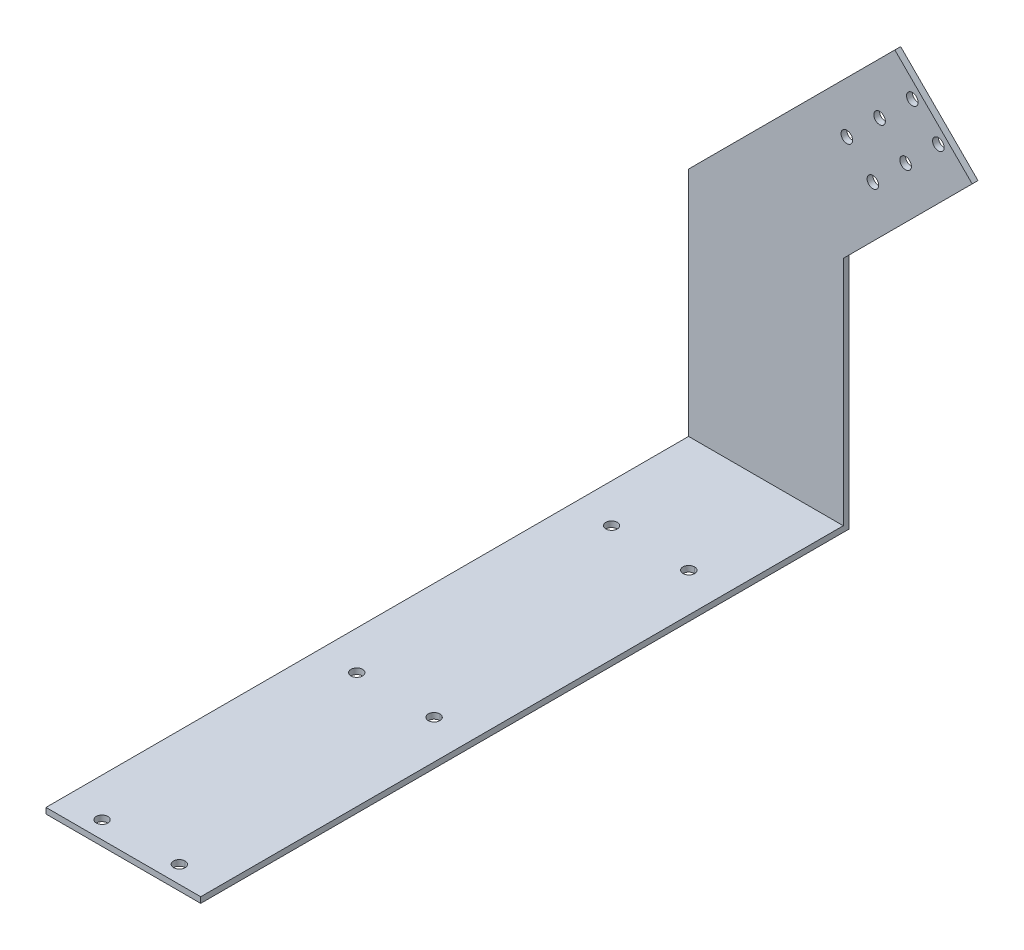
from build123d import *

# Parameters (mm, degrees)
SKETCH1_R           = 161.29
BOSS_EXTRUDE1_DEPTH = 161.29
SKETCH3_W           = 4310.634
SKETCH3_H           = 18064.48
SKETCH3_R           = 161.29
SKETCH3_R_2         = 161.290000004
BOSS_EXTRUDE3_DEPTH = 161.29
SCALE1_SCALE        = 0.039370079


with BuildPart() as part:
    # Sketch1 → Boss-Extrude1 (new body)
    with BuildSketch(Plane.XY):
        Polygon((-2155.317, 3225.8), (3592.046917484, 8973.163917484), (5747.419448428, 6817.902448428), (2155.317, 3225.8), (2155.317, -3225.8), (-2155.317, -3225.8), align=None)
        with Locations((4804.833357851, 7304.254711836)):
            Circle(SKETCH1_R, mode=Mode.SUBTRACT)
        with Locations((3892.43933595, 6391.860689935)):
            Circle(SKETCH1_R, mode=Mode.SUBTRACT)
        with Locations((2980.04531405, 5479.466668034)):
            Circle(SKETCH1_R, mode=Mode.SUBTRACT)
        with Locations(Location((2253.753739605, 6205.720818177, 0), (0, 0, 180))):
            Circle(SKETCH1_R, mode=Mode.SUBTRACT)
        with Locations(Location((3166.100745307, 7118.161853854, 0), (0, 0, 180))):
            Circle(SKETCH1_R, mode=Mode.SUBTRACT)
        with Locations(Location((4078.447751009, 8030.602889531, 0), (0, 0, 180))):
            Circle(SKETCH1_R, mode=Mode.SUBTRACT)
    extrude(amount=BOSS_EXTRUDE1_DEPTH)

    # Sketch3 → Boss-Extrude3 (add)
    with BuildSketch(Plane(origin=(0, -3225.8, 0), x_dir=(-1, 0, 0), z_dir=(0, -1, 0))):
        with Locations((0, -9032.24)):
            Rectangle(SKETCH3_W, SKETCH3_H)
        with BuildLine():
            ThreePointArc((-1076.325000239, -17741.894999924), (-1238.885, -17580.61), (-1076.325000239, -17419.325000076))
            ThreePointArc((-1076.325000239, -17419.325000076), (-961.455647534, -17466.112614792), (-913.765, -17580.61))
            ThreePointArc((-913.765, -17580.61), (-961.455647534, -17695.107385209), (-1076.325000239, -17741.894999924))
        make_face(mode=Mode.SUBTRACT)
        with BuildLine():
            ThreePointArc((-1076.325000236, -10645.134999924), (-1238.885, -10483.85), (-1076.325000236, -10322.565000076))
            ThreePointArc((-1076.325000236, -10322.565000076), (-961.455647533, -10369.352614793), (-913.765, -10483.85))
            ThreePointArc((-913.765, -10483.85), (-961.455647533, -10598.347385207), (-1076.325000236, -10645.134999924))
        make_face(mode=Mode.SUBTRACT)
        with Locations(Location((1077.595, -17580.609999999, 0), (0, 0, 180))):
            Circle(SKETCH3_R, mode=Mode.SUBTRACT)
        with Locations(Location((1077.594999996, -10483.849999999, 0), (0, 0, 180))):
            Circle(SKETCH3_R_2, mode=Mode.SUBTRACT)
        with BuildLine():
            ThreePointArc((-1076.325000236, -3225.805000076), (-961.455647533, -3272.592614793), (-913.765, -3387.09))
            ThreePointArc((-913.765, -3387.09), (-961.455647533, -3501.587385207), (-1076.325000236, -3548.374999924))
            ThreePointArc((-1076.325000236, -3548.374999924), (-1238.885, -3387.09), (-1076.325000236, -3225.805000076))
        make_face(mode=Mode.SUBTRACT)
        with Locations(Location((1075.054999996, -3387.089999999, 0), (0, 0, 180))):
            Circle(SKETCH3_R_2, mode=Mode.SUBTRACT)
    extrude(amount=BOSS_EXTRUDE3_DEPTH)


with BuildPart() as part_1:
    # Scale1: scaled about (342.584657251, -1172.717670217, 5623.777851713)
    add(part.part.scale(SCALE1_SCALE).moved(Location((329.09707232, -1126.547683201, 5402.369274874))))


solid = part_1.part
